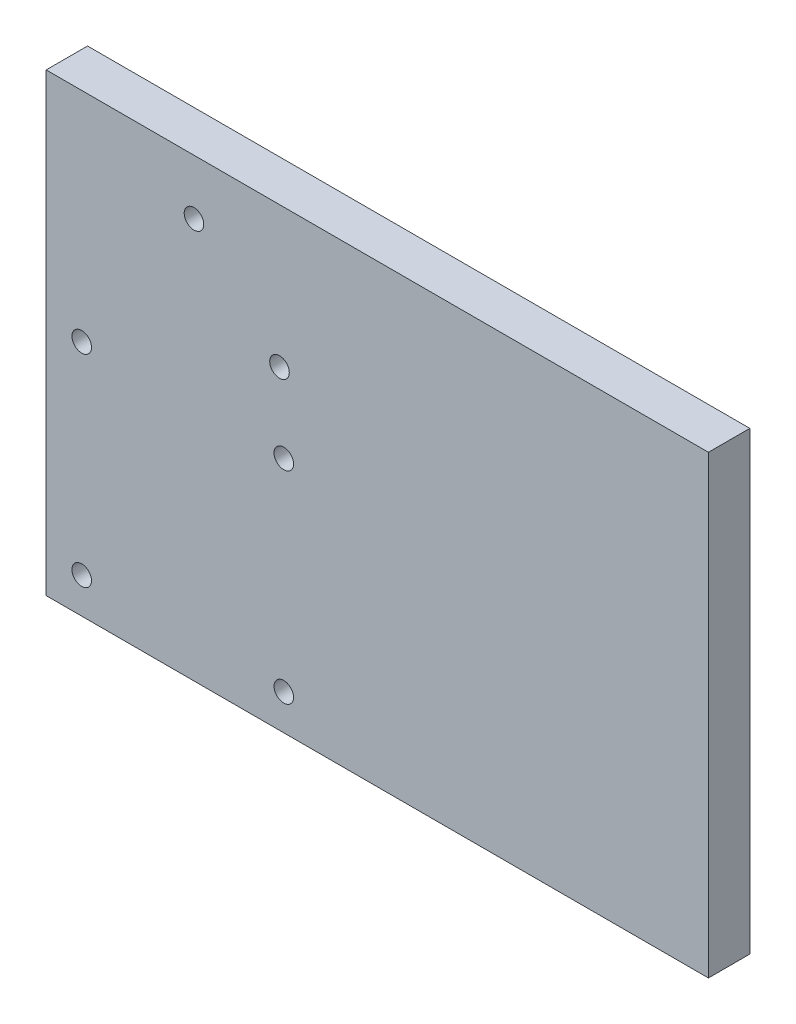
from build123d import *

# Parameters (mm, degrees)
SKETCH1_W           = 101.6
SKETCH1_H           = 69.85
BOSS_EXTRUDE1_DEPTH = 6.35
SKETCH2_R           = 1.5
CUT_EXTRUDE1_DEPTH  = 124.458110305


with BuildPart() as part:
    # Sketch1 → Boss-Extrude1 (new body)
    with BuildSketch(Plane.XY):
        with Locations((50.8, 34.925)):
            Rectangle(SKETCH1_W, SKETCH1_H)
    extrude(amount=BOSS_EXTRUDE1_DEPTH)

    # Sketch2 → Cut-Extrude1 (cut, through all)
    with BuildSketch(Plane.XY.offset(6.35)):
        with Locations((5.455, 5.455)):
            Circle(SKETCH2_R)
        with Locations((5.455, 36.455)):
            Circle(SKETCH2_R)
        with Locations((36.455, 5.455)):
            Circle(SKETCH2_R)
        with Locations((36.455, 36.455)):
            Circle(SKETCH2_R)
        with Locations((22.674739828, 61.399260172)):
            Circle(SKETCH2_R)
        with Locations((35.796060172, 48.277939828)):
            Circle(SKETCH2_R)
    extrude(amount=-CUT_EXTRUDE1_DEPTH, mode=Mode.SUBTRACT)


solid = part.part
